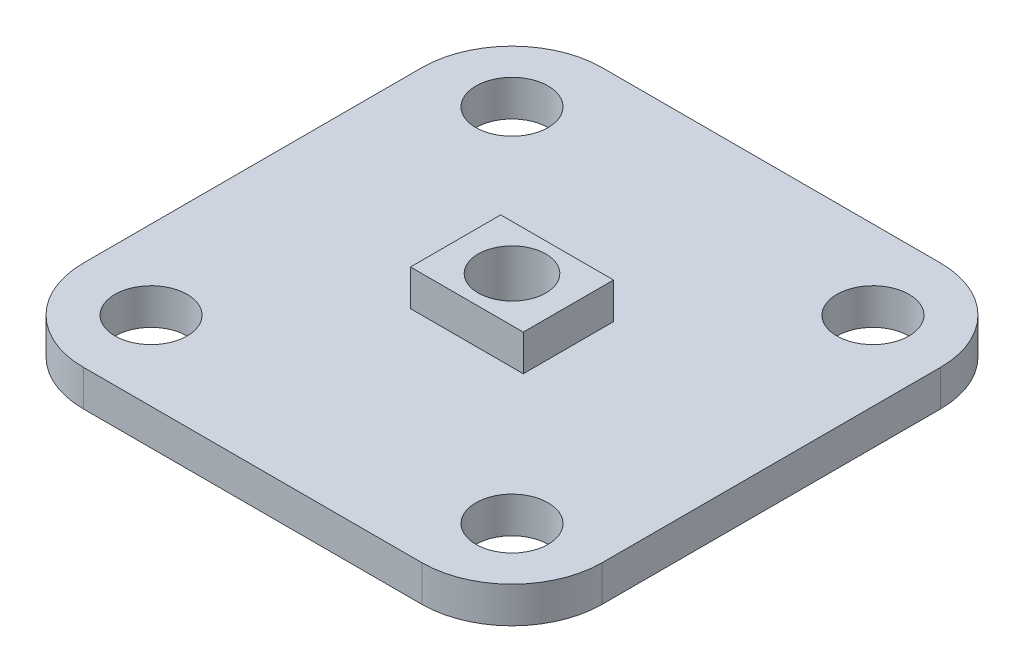
from build123d import *

# Parameters (mm, degrees)
SKETCH_1_W          = 23
SKETCH_1_H          = 23
EXTRUDE_1_DEPTH     = 1.6
SKETCH_2_W          = 5
SKETCH_2_H          = 4
EXTRUDE_2_DEPTH     = 1.6
FILLET_1_R          = 4
CUT_EXTRUDE_1_REACH = 18.575
SKETCH_3_R          = 1.6
CUT_EXTRUDE_2_REACH = 18.575
SKETCH_4_R          = 1.5


with BuildPart() as part:
    # 草图1 → 凸台-拉伸1 (new body)
    with BuildSketch(Plane(origin=(0, 0, 0), x_dir=(1, 0, 0), z_dir=(0, 1, 0))):
        Rectangle(SKETCH_1_W, SKETCH_1_H)
    extrude(amount=EXTRUDE_1_DEPTH)

    # 草图2 → 凸台-拉伸2 (add)
    with BuildSketch(Plane(origin=(0, 1.6, 0), x_dir=(1, 0, 0), z_dir=(0, 1, 0))):
        Rectangle(SKETCH_2_W, SKETCH_2_H)
    extrude(amount=EXTRUDE_2_DEPTH)

    # 圆角1
    fillet_1_edges = [part.edges().sort_by_distance(p)[0] for p in [
        (11.5, 0.8, 11.5),
        (-11.5, 0.8, 11.5),
        (-11.5, 0.8, -11.5),
        (11.5, 0.8, -11.5),
    ]]
    fillet(fillet_1_edges, radius=FILLET_1_R)

    # 草图3 → 切除-拉伸1 (cut, up to next)
    with BuildSketch(Plane.XZ, mode=Mode.PRIVATE) as cut_extrude_1_sk1:
        with Locations(Location((-8, 8, 0), (0, 0, 270))):
            Circle(SKETCH_3_R)
    cut_extrude_1_tool1 = extrude(cut_extrude_1_sk1.sketch, amount=-CUT_EXTRUDE_1_REACH, mode=Mode.PRIVATE) & part.part
    # 草图3 → 切除-拉伸1 (cut, up to next)
    with BuildSketch(Plane.XZ, mode=Mode.PRIVATE) as cut_extrude_1_sk2:
        with Locations(Location((8, 8, 0), (0, 0, 270))):
            Circle(SKETCH_3_R)
    cut_extrude_1_tool2 = extrude(cut_extrude_1_sk2.sketch, amount=-CUT_EXTRUDE_1_REACH, mode=Mode.PRIVATE) & part.part
    # 草图3 → 切除-拉伸1 (cut, up to next)
    with BuildSketch(Plane.XZ, mode=Mode.PRIVATE) as cut_extrude_1_sk3:
        with Locations(Location((8, -8, 0), (0, 0, 270))):
            Circle(SKETCH_3_R)
    cut_extrude_1_tool3 = extrude(cut_extrude_1_sk3.sketch, amount=-CUT_EXTRUDE_1_REACH, mode=Mode.PRIVATE) & part.part
    # 草图3 → 切除-拉伸1 (cut, up to next)
    with BuildSketch(Plane.XZ, mode=Mode.PRIVATE) as cut_extrude_1_sk4:
        with Locations(Location((-8, -8, 0), (0, 0, 270))):
            Circle(SKETCH_3_R)
    cut_extrude_1_tool4 = extrude(cut_extrude_1_sk4.sketch, amount=-CUT_EXTRUDE_1_REACH, mode=Mode.PRIVATE) & part.part
    add(cut_extrude_1_tool1.solids().sort_by_distance((-8, 0, 8))[0], mode=Mode.SUBTRACT)
    add(cut_extrude_1_tool2.solids().sort_by_distance((8, 0, 8))[0], mode=Mode.SUBTRACT)
    add(cut_extrude_1_tool3.solids().sort_by_distance((8, 0, -8))[0], mode=Mode.SUBTRACT)
    add(cut_extrude_1_tool4.solids().sort_by_distance((-8, 0, -8))[0], mode=Mode.SUBTRACT)

    # 草图4 → 切除-拉伸2 (cut, up to next)
    with BuildSketch(Plane.XZ, mode=Mode.PRIVATE) as cut_extrude_2_sk1:
        with Locations(Location((0, 0, 0), (0, 0, 270))):
            Circle(SKETCH_4_R)
    cut_extrude_2_tool1 = extrude(cut_extrude_2_sk1.sketch, amount=-CUT_EXTRUDE_2_REACH, mode=Mode.PRIVATE) & part.part
    add(cut_extrude_2_tool1.solids().sort_by_distance((0, 0, 0))[0], mode=Mode.SUBTRACT)


solid = part.part
